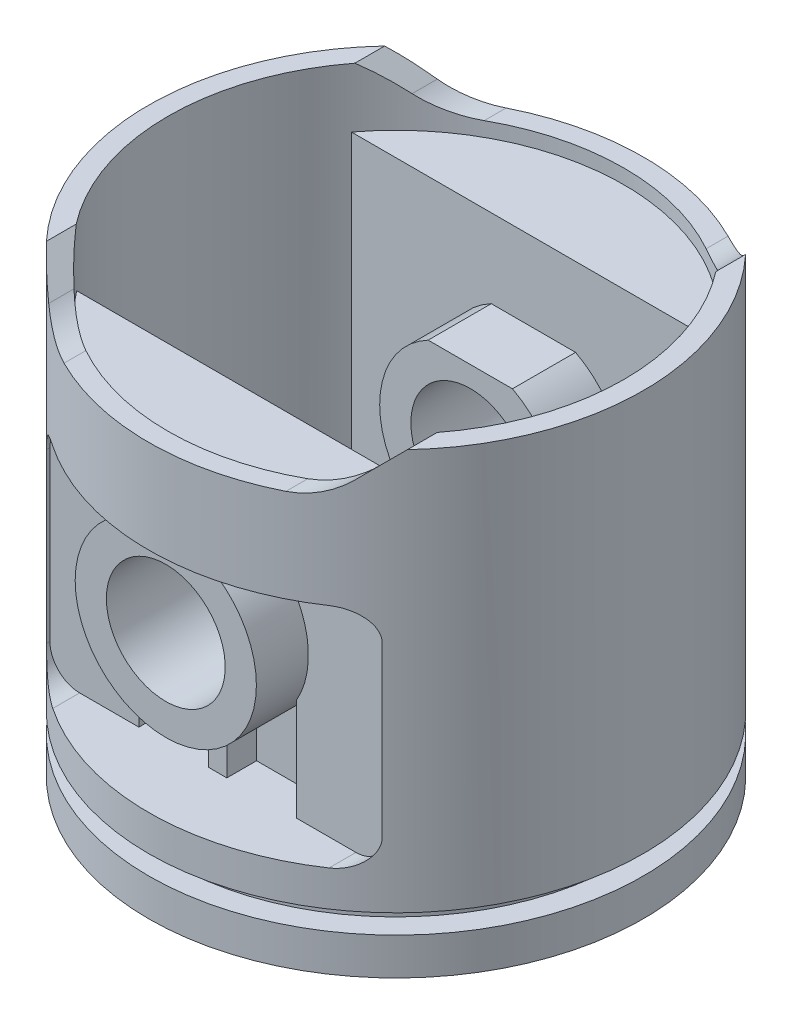
from build123d import *
from build123d.topology import SkipClean

# Parameters (mm, degrees)
SKETCH1_R               = 16.65
BOSS_EXTRUDE1_DEPTH     = 2.5
SKETCH2_R               = 15.15
BOSS_EXTRUDE2_DEPTH     = 1.3
SKETCH3_R               = 16.65
BOSS_EXTRUDE3_DEPTH     = 27
CUT_EXTRUDE1_DEPTH      = 27
CUT_EXTRUDE1_DEPTH_BACK = 27
CUT_EXTRUDE2_DEPTH      = 26
CUT_EXTRUDE3_DEPTH      = 12.5
BOSS_EXTRUDE4_START     = -7
SKETCH8_R               = 4
BOSS_EXTRUDE4_DEPTH     = 10.5
FILLET1_R               = 3
SKETCH9_R               = 4
CUT_EXTRUDE4_DEPTH      = 33.5
CUT_EXTRUDE5_DEPTH      = 2
SKETCH11_R              = 15.35
CUT_EXTRUDE6_DEPTH      = 4


with BuildPart() as part:
    # Sketch1 → Boss-Extrude1 (new body)
    with BuildSketch(Plane(origin=(0, 0, 0), x_dir=(1, 0, 0), z_dir=(0, 1, 0))):
        Circle(SKETCH1_R)
    extrude(amount=BOSS_EXTRUDE1_DEPTH)

    # Sketch2 → Boss-Extrude2 (add)
    with BuildSketch(Plane(origin=(0, 2.5, 0), x_dir=(1, 0, 0), z_dir=(0, 1, 0))):
        Circle(SKETCH2_R)
    extrude(amount=BOSS_EXTRUDE2_DEPTH)

    # Sketch3 → Boss-Extrude3 (add)
    with BuildSketch(Plane(origin=(0, 3.8, 0), x_dir=(1, 0, 0), z_dir=(0, 1, 0))):
        Circle(SKETCH3_R)
    extrude(amount=BOSS_EXTRUDE3_DEPTH)

    # Sketch4 → Cut-Extrude1 (cut, two sides: drawn at the far end of the back side and taken through both)
    with BuildSketch(Plane.XY.offset(-CUT_EXTRUDE1_DEPTH_BACK)):
        with BuildLine():
            Line((-12.15, 30.8), (-10.299201712, 28.949201712))
            ThreePointArc((-10.299201712, 28.949201712), (-9.001508317, 28.082110707), (-7.470774587, 27.777628837))
            Line((-7.470774587, 27.777628837), (7.470774587, 27.777628837))
            ThreePointArc((7.470774587, 27.777628837), (9.001508317, 28.082110707), (10.299201712, 28.949201712))
            Line((10.299201712, 28.949201712), (12.15, 30.8))
            Line((12.15, 30.8), (-12.15, 30.8))
        make_face()
    extrude(amount=CUT_EXTRUDE1_DEPTH + CUT_EXTRUDE1_DEPTH_BACK, mode=Mode.SUBTRACT)

    # Sketch6 → Cut-Extrude2 (cut)
    with BuildSketch(Plane(origin=(0, 30.8, 0), x_dir=(1, 0, 0), z_dir=(0, 1, 0))):
        with BuildLine():
            Line((-12.249897959, 9.25), (12.249897959, 9.25))
            ThreePointArc((12.249897959, 9.25), (15.35, 0), (12.249897959, -9.25))
            Line((12.249897959, -9.25), (-12.249897959, -9.25))
            ThreePointArc((-12.249897959, -9.25), (-15.35, 0), (-12.249897959, 9.25))
        make_face()
    extrude(amount=-CUT_EXTRUDE2_DEPTH, mode=Mode.SUBTRACT)

    # Sketch7 → Cut-Extrude3 (cut)
    with BuildSketch(Plane.XY.offset(24.5)):
        with BuildLine():
            Line((-9.3, 6.2), (9.3, 6.2))
            ThreePointArc((9.3, 6.2), (10.714213562, 6.785786438), (11.3, 8.2))
            Line((11.3, 8.2), (11.3, 19.5))
            ThreePointArc((11.3, 19.5), (10.714213562, 20.914213562), (9.3, 21.5))
            Line((9.3, 21.5), (-9.3, 21.5))
            ThreePointArc((-9.3, 21.5), (-10.714213562, 20.914213562), (-11.3, 19.5))
            Line((-11.3, 19.5), (-11.3, 8.2))
            ThreePointArc((-11.3, 8.2), (-10.714213562, 6.785786438), (-9.3, 6.2))
        make_face()
    cut_extrude3 = extrude(amount=-CUT_EXTRUDE3_DEPTH, mode=Mode.SUBTRACT)

    # Mirror1: Cut-Extrude3 across plane
    add(cut_extrude3.mirror(Plane.XY), mode=Mode.SUBTRACT)

    # Sketch8 → Boss-Extrude4 (add)
    with BuildSketch(Plane(origin=(0, 0, -12), x_dir=(-1, 0, 0), z_dir=(0, 0, -1)).offset(BOSS_EXTRUDE4_START)):
        with BuildLine():
            Line((-2.837252192, 21.5), (2.837252192, 21.5))
            ThreePointArc((2.837252192, 21.5), (0, 10), (-2.837252192, 21.5))
        make_face()
        with Locations((0, 16.1)):
            Circle(SKETCH8_R, mode=Mode.SUBTRACT)
    boss_extrude4 = extrude(amount=BOSS_EXTRUDE4_DEPTH)

    # Mirror2: Boss-Extrude4 across plane
    add(boss_extrude4.mirror(Plane.XY))

    # Fillet1
    fillet1_edges = [part.edges().sort_by_distance(p)[0] for p in [
        (0, 4.8, 9.25),
        (-15.35, 4.8, 0),
        (0, 4.8, -9.25),
        (15.35, 4.8, 0),
    ]]
    fillet(fillet1_edges, radius=FILLET1_R)

    # Sketch9 → Cut-Extrude4 (cut)
    with BuildSketch(Plane(origin=(0, 0, -12), x_dir=(-1, 0, 0), z_dir=(0, 0, -1))):
        with Locations((0, 16.1)):
            Circle(SKETCH9_R)
    extrude(amount=-CUT_EXTRUDE4_DEPTH, mode=Mode.SUBTRACT)

    # Sketch10 → Cut-Extrude5 (cut)
    with SkipClean():  # the faces are left unmerged after this step: merging them gives an invalid solid
        with BuildSketch(Plane(origin=(0, 0, -12), x_dir=(-1, 0, 0), z_dir=(0, 0, -1))):
            with BuildLine():
                Line((0.611782833, 6.2), (0.611782833, 10.03075608))
                ThreePointArc((0.611782833, 10.03075608), (3.335542493, 10.992734952), (5.311313245, 13.100008065))
                Line((5.311313245, 13.100008065), (5.311313245, 6.2))
                Line((5.311313245, 6.2), (0.611782833, 6.2))
            make_face()
            with BuildLine():
                Line((-5.311313245, 6.2), (-5.311313245, 13.100008065))
                ThreePointArc((-5.311313245, 13.100008065), (-3.335542493, 10.992734952), (-0.611782833, 10.03075608))
                Line((-0.611782833, 10.03075608), (-0.611782833, 6.2))
                Line((-0.611782833, 6.2), (-5.311313245, 6.2))
            make_face()
        cut_extrude5 = extrude(amount=-CUT_EXTRUDE5_DEPTH, mode=Mode.SUBTRACT)

    # Mirror3: Cut-Extrude5 across plane
    with SkipClean():  # the faces are left unmerged after this step: merging them gives an invalid solid
        add(cut_extrude5.mirror(Plane.XY), mode=Mode.SUBTRACT)

    # Sketch11 → Cut-Extrude6 (cut)
    with SkipClean():  # the faces are left unmerged after this step: merging them gives an invalid solid
        with BuildSketch(Plane(origin=(0, 30.8, 0), x_dir=(1, 0, 0), z_dir=(0, 1, 0))):
            Circle(SKETCH11_R)
        extrude(amount=-CUT_EXTRUDE6_DEPTH, mode=Mode.SUBTRACT)


solid = part.part
